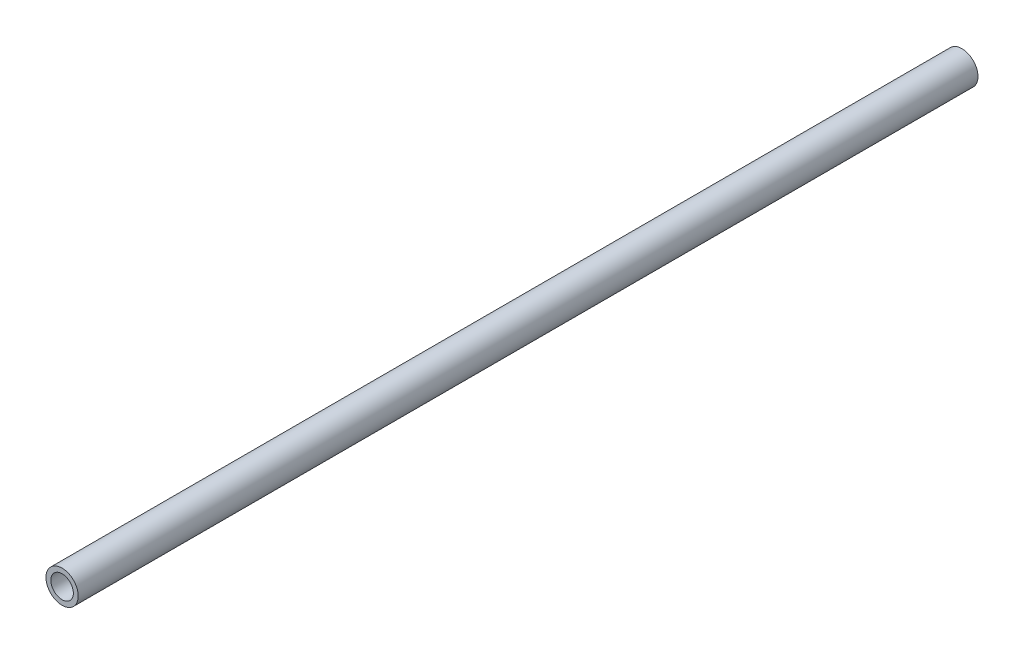
from build123d import *

# Parameters (mm, degrees)
SKETCH1_R           = 10.75
SKETCH1_R_2         = 7.5
BOSS_EXTRUDE1_DEPTH = 600


with BuildPart() as part:
    # Sketch1 → Boss-Extrude1 (new body)
    with BuildSketch(Plane.XY):
        Circle(SKETCH1_R)
        Circle(SKETCH1_R_2, mode=Mode.SUBTRACT)
    extrude(amount=BOSS_EXTRUDE1_DEPTH)


solid = part.part
